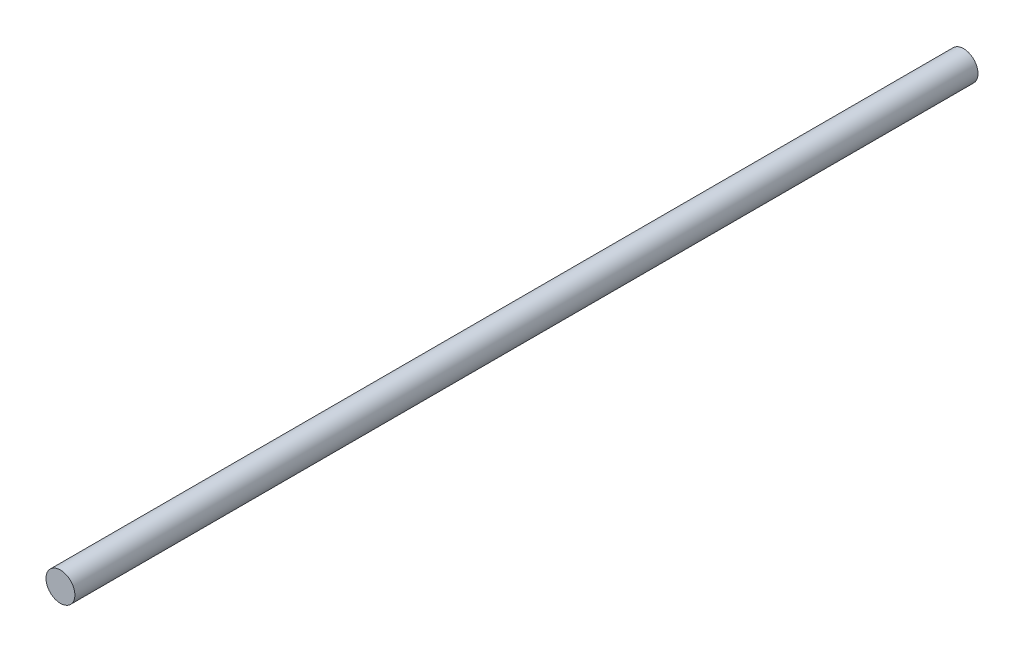
from build123d import *

# Parameters (mm, degrees)
SKETCH1_R           = 4
BOSS_EXTRUDE1_DEPTH = 250


with BuildPart() as part:
    # Sketch1 → Boss-Extrude1 (new body)
    with BuildSketch(Plane.XY):
        with Locations((-5.987136889, 4.964489284)):
            Circle(SKETCH1_R)
    extrude(amount=BOSS_EXTRUDE1_DEPTH)


solid = part.part
